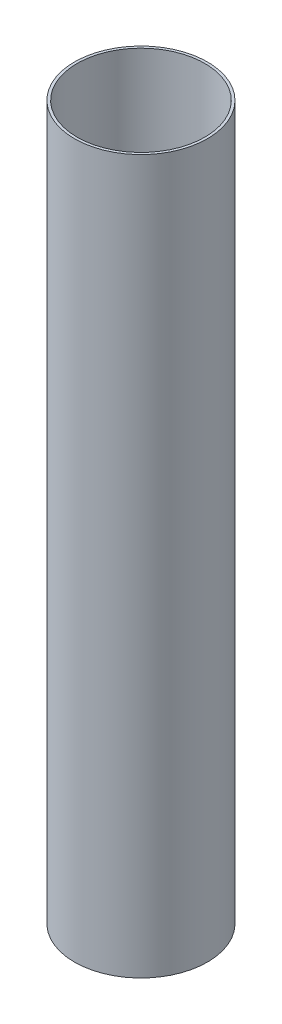
from build123d import *

# Parameters (mm, degrees)
SKETCH1_R           = 28.4988
SKETCH1_R_2         = 27.3812
BOSS_EXTRUDE1_DEPTH = 305.562


with BuildPart() as part:
    # Sketch1 → Boss-Extrude1 (new body)
    with BuildSketch(Plane(origin=(0, 0, 0), x_dir=(1, 0, 0), z_dir=(0, 1, 0))):
        with Locations(Location((0, 0, 0), (0, 0, 270))):
            Circle(SKETCH1_R)
        with Locations(Location((0, 0, 0), (0, 0, 270))):
            Circle(SKETCH1_R_2, mode=Mode.SUBTRACT)
    extrude(amount=BOSS_EXTRUDE1_DEPTH)


solid = part.part
